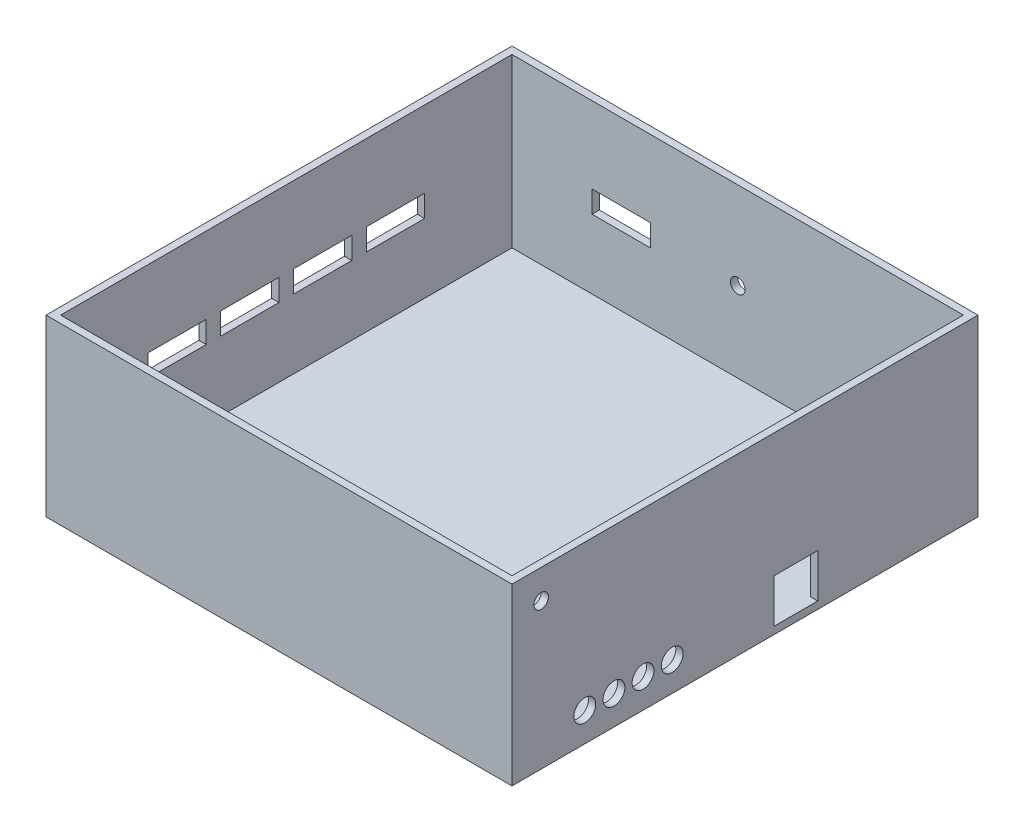
from build123d import *

# Parameters (mm, degrees)
SKETCH1_W                      = 203.2
SKETCH1_H                      = 203.2
BOSS_EXTRUDE1_DEPTH            = 76.2
SKETCH2_W                      = 196.85
SKETCH2_H                      = 196.85
CUT_EXTRUDE1_DEPTH             = 73.025
CUT_EXTRUDE2_REACH             = 241.623
SKETCH3_R                      = 4.7625
SKETCH3_R_2                    = 3.175
SKETCH3_W                      = 19.05
SKETCH3_H                      = 19.05
CUT_EXTRUDE2_DIRECTION_2_DEPTH = 240.623120754
CUT_EXTRUDE3_REACH             = 241.623
SKETCH4_R                      = 3.175
SKETCH4_W                      = 25.4
SKETCH4_H                      = 9.525
CUT_EXTRUDE4_REACH             = 241.623
SKETCH5_W                      = 25.4
SKETCH5_H                      = 9.525


with BuildPart() as part:
    # Sketch1 → Boss-Extrude1 (new body)
    with BuildSketch(Plane(origin=(0, 0, 0), x_dir=(1, 0, 0), z_dir=(0, 1, 0))):
        Rectangle(SKETCH1_W, SKETCH1_H)
    extrude(amount=BOSS_EXTRUDE1_DEPTH)

    # Sketch2 → Cut-Extrude1 (cut)
    with BuildSketch(Plane(origin=(0, 76.2, 0), x_dir=(1, 0, 0), z_dir=(0, 1, 0))):
        Rectangle(SKETCH2_W, SKETCH2_H)
    extrude(amount=-CUT_EXTRUDE1_DEPTH, mode=Mode.SUBTRACT)

    # Sketch3 → Cut-Extrude2 (cut, up to next)
    with BuildSketch(Plane(origin=(101.6, 0, 0), x_dir=(0, 0, -1), z_dir=(1, 0, 0)), mode=Mode.PRIVATE) as cut_extrude2_sk1:
        with Locations(Location((-69.85, 12.7, 0), (0, 0, 180))):
            Circle(SKETCH3_R)
    cut_extrude2_tool1 = extrude(cut_extrude2_sk1.sketch, amount=-CUT_EXTRUDE2_REACH, mode=Mode.PRIVATE) & part.part
    # Sketch3 → Cut-Extrude2 (cut, up to next)
    with BuildSketch(Plane(origin=(101.6, 0, 0), x_dir=(0, 0, -1), z_dir=(1, 0, 0)), mode=Mode.PRIVATE) as cut_extrude2_sk2:
        with Locations(Location((-57.15, 12.7, 0), (0, 0, 180))):
            Circle(SKETCH3_R)
    cut_extrude2_tool2 = extrude(cut_extrude2_sk2.sketch, amount=-CUT_EXTRUDE2_REACH, mode=Mode.PRIVATE) & part.part
    # Sketch3 → Cut-Extrude2 (cut, up to next)
    with BuildSketch(Plane(origin=(101.6, 0, 0), x_dir=(0, 0, -1), z_dir=(1, 0, 0)), mode=Mode.PRIVATE) as cut_extrude2_sk3:
        with Locations(Location((-44.45, 12.7, 0), (0, 0, 180))):
            Circle(SKETCH3_R)
    cut_extrude2_tool3 = extrude(cut_extrude2_sk3.sketch, amount=-CUT_EXTRUDE2_REACH, mode=Mode.PRIVATE) & part.part
    # Sketch3 → Cut-Extrude2 (cut, up to next)
    with BuildSketch(Plane(origin=(101.6, 0, 0), x_dir=(0, 0, -1), z_dir=(1, 0, 0)), mode=Mode.PRIVATE) as cut_extrude2_sk4:
        with Locations(Location((-31.75, 12.7, 0), (0, 0, 180))):
            Circle(SKETCH3_R)
    cut_extrude2_tool4 = extrude(cut_extrude2_sk4.sketch, amount=-CUT_EXTRUDE2_REACH, mode=Mode.PRIVATE) & part.part
    # Sketch3 → Cut-Extrude2 (cut, up to next)
    with BuildSketch(Plane(origin=(101.6, 0, 0), x_dir=(0, 0, -1), z_dir=(1, 0, 0)), mode=Mode.PRIVATE) as cut_extrude2_sk5:
        with Locations(Location((-88.9, 63.5, 0), (0, 0, 180))):
            Circle(SKETCH3_R_2)
    cut_extrude2_tool5 = extrude(cut_extrude2_sk5.sketch, amount=-CUT_EXTRUDE2_REACH, mode=Mode.PRIVATE) & part.part
    # Sketch3 → Cut-Extrude2 (cut, up to next)
    with BuildSketch(Plane(origin=(101.6, 0, 0), x_dir=(0, 0, -1), z_dir=(1, 0, 0)), mode=Mode.PRIVATE) as cut_extrude2_sk6:
        with Locations((22.225, 12.7)):
            Rectangle(SKETCH3_W, SKETCH3_H)
    cut_extrude2_tool6 = extrude(cut_extrude2_sk6.sketch, amount=-CUT_EXTRUDE2_REACH, mode=Mode.PRIVATE) & part.part
    add(cut_extrude2_tool1.solids().sort_by_distance((101.6, 12.7, 69.85))[0], mode=Mode.SUBTRACT)
    add(cut_extrude2_tool2.solids().sort_by_distance((101.6, 12.7, 57.15))[0], mode=Mode.SUBTRACT)
    add(cut_extrude2_tool3.solids().sort_by_distance((101.6, 12.7, 44.45))[0], mode=Mode.SUBTRACT)
    add(cut_extrude2_tool4.solids().sort_by_distance((101.6, 12.7, 31.75))[0], mode=Mode.SUBTRACT)
    add(cut_extrude2_tool5.solids().sort_by_distance((101.6, 63.5, 88.9))[0], mode=Mode.SUBTRACT)
    add(cut_extrude2_tool6.solids().sort_by_distance((101.6, 12.7, -22.225))[0], mode=Mode.SUBTRACT)

    # Sketch3 → Cut-Extrude2 direction 2 (cut)
    with BuildSketch(Plane(origin=(101.6, 0, 0), x_dir=(0, 0, -1), z_dir=(1, 0, 0))):
        with Locations(Location((-69.85, 12.7, 0), (0, 0, 180))):
            Circle(SKETCH3_R)
        with Locations(Location((-57.15, 12.7, 0), (0, 0, 180))):
            Circle(SKETCH3_R)
        with Locations(Location((-44.45, 12.7, 0), (0, 0, 180))):
            Circle(SKETCH3_R)
        with Locations(Location((-31.75, 12.7, 0), (0, 0, 180))):
            Circle(SKETCH3_R)
        with Locations(Location((-88.9, 63.5, 0), (0, 0, 180))):
            Circle(SKETCH3_R_2)
        with Locations((22.225, 12.7)):
            Rectangle(SKETCH3_W, SKETCH3_H)
    extrude(amount=CUT_EXTRUDE2_DIRECTION_2_DEPTH, mode=Mode.SUBTRACT)

    # Sketch4 → Cut-Extrude3 (cut, up to next)
    with BuildSketch(Plane(origin=(0, 0, -101.6), x_dir=(-1, 0, 0), z_dir=(0, 0, -1)), mode=Mode.PRIVATE) as cut_extrude3_sk1:
        with Locations((0, 38.1)):
            Circle(SKETCH4_R)
    cut_extrude3_tool1 = extrude(cut_extrude3_sk1.sketch, amount=-CUT_EXTRUDE3_REACH, mode=Mode.PRIVATE) & part.part
    # Sketch4 → Cut-Extrude3 (cut, up to next)
    with BuildSketch(Plane(origin=(0, 0, -101.6), x_dir=(-1, 0, 0), z_dir=(0, 0, -1)), mode=Mode.PRIVATE) as cut_extrude3_sk2:
        with Locations((50.8, 38.1)):
            Rectangle(SKETCH4_W, SKETCH4_H)
    cut_extrude3_tool2 = extrude(cut_extrude3_sk2.sketch, amount=-CUT_EXTRUDE3_REACH, mode=Mode.PRIVATE) & part.part
    add(cut_extrude3_tool1.solids().sort_by_distance((0, 38.1, -101.6))[0], mode=Mode.SUBTRACT)
    add(cut_extrude3_tool2.solids().sort_by_distance((-50.8, 38.1, -101.6))[0], mode=Mode.SUBTRACT)

    # Sketch5 → Cut-Extrude4 (cut, up to next)
    with BuildSketch(Plane.ZY.offset(101.6), mode=Mode.PRIVATE) as cut_extrude4_sk1:
        with Locations((-15.875, 38.1)):
            Rectangle(SKETCH5_W, SKETCH5_H)
    cut_extrude4_tool1 = extrude(cut_extrude4_sk1.sketch, amount=-CUT_EXTRUDE4_REACH, mode=Mode.PRIVATE) & part.part
    # Sketch5 → Cut-Extrude4 (cut, up to next)
    with BuildSketch(Plane.ZY.offset(101.6), mode=Mode.PRIVATE) as cut_extrude4_sk2:
        with Locations((-47.625, 38.1)):
            Rectangle(SKETCH5_W, SKETCH5_H)
    cut_extrude4_tool2 = extrude(cut_extrude4_sk2.sketch, amount=-CUT_EXTRUDE4_REACH, mode=Mode.PRIVATE) & part.part
    # Sketch5 → Cut-Extrude4 (cut, up to next)
    with BuildSketch(Plane.ZY.offset(101.6), mode=Mode.PRIVATE) as cut_extrude4_sk3:
        with Locations((47.625, 38.1)):
            Rectangle(SKETCH5_W, SKETCH5_H)
    cut_extrude4_tool3 = extrude(cut_extrude4_sk3.sketch, amount=-CUT_EXTRUDE4_REACH, mode=Mode.PRIVATE) & part.part
    # Sketch5 → Cut-Extrude4 (cut, up to next)
    with BuildSketch(Plane.ZY.offset(101.6), mode=Mode.PRIVATE) as cut_extrude4_sk4:
        with Locations((15.875, 38.1)):
            Rectangle(SKETCH5_W, SKETCH5_H)
    cut_extrude4_tool4 = extrude(cut_extrude4_sk4.sketch, amount=-CUT_EXTRUDE4_REACH, mode=Mode.PRIVATE) & part.part
    add(cut_extrude4_tool1.solids().sort_by_distance((-101.6, 38.1, -15.875))[0], mode=Mode.SUBTRACT)
    add(cut_extrude4_tool2.solids().sort_by_distance((-101.6, 38.1, -47.625))[0], mode=Mode.SUBTRACT)
    add(cut_extrude4_tool3.solids().sort_by_distance((-101.6, 38.1, 47.625))[0], mode=Mode.SUBTRACT)
    add(cut_extrude4_tool4.solids().sort_by_distance((-101.6, 38.1, 15.875))[0], mode=Mode.SUBTRACT)


solid = part.part
